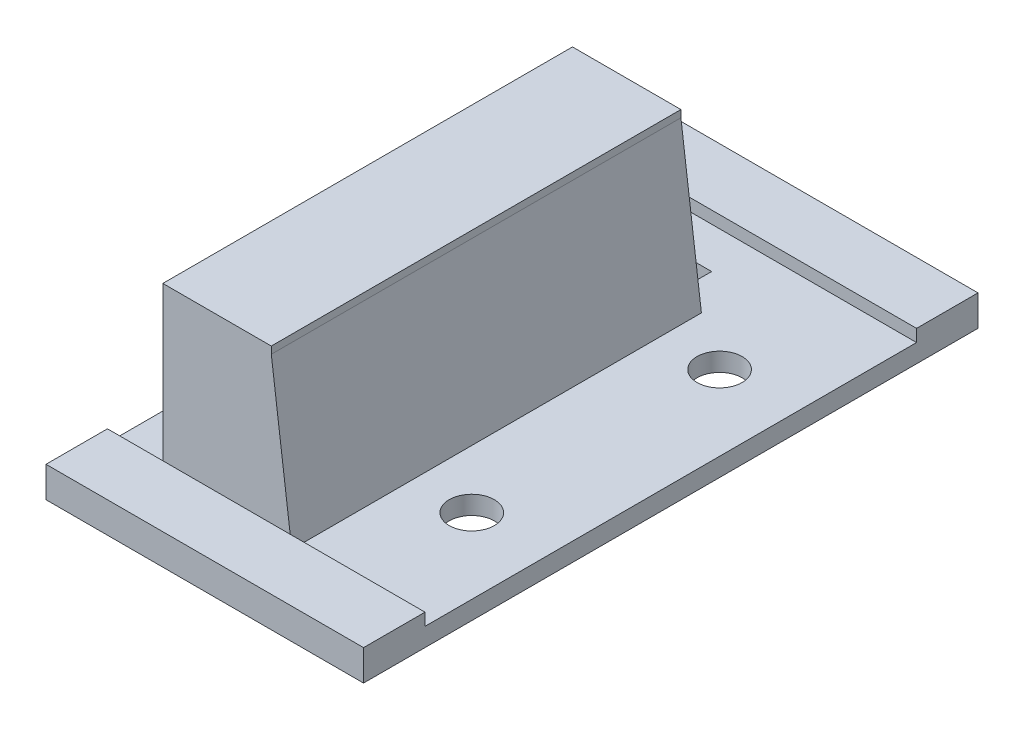
from build123d import *

# Parameters (mm, degrees)
BOSS_EXTRUDE2_DEPTH   = 3.81
BOSS_EXTRUDE2_2_DEPTH = 3.81
SKETCH2_3_W           = 39.3827
SKETCH2_3_H           = 60.96
SKETCH2_3_R           = 2.794
SKETCH2_3_W_2         = 7.874
SKETCH2_3_H_2         = 50.8
BOSS_EXTRUDE3_DEPTH   = 2.286
SKETCH2_4_W           = 0.75
SKETCH2_4_H           = 50.8
BOSS_EXTRUDE4_DEPTH   = 22.86
SKETCH7_W             = 50.8
SKETCH7_H             = 0.889
BOSS_EXTRUDE6_DEPTH   = 12.7
BOSS_EXTRUDE7_DEPTH   = 0.889
BOSS_EXTRUDE8_DEPTH   = 50.8
SKETCH10_W            = 11.873277716
SKETCH10_H            = 49.911
CUT_EXTRUDE5_DEPTH    = 89.208426668


with BuildPart() as part:
    # Sketch2 → Boss-Extrude2 (new body)
    with BuildSketch(Plane(origin=(0, 0, 0), x_dir=(1, 0, 0), z_dir=(0, 1, 0))):
        Polygon((0, 7.62), (0, 0), (39.3827, 0), (39.3827, 7.62), (7.62, 7.62), (6.87, 7.62), align=None)
    extrude(amount=BOSS_EXTRUDE2_DEPTH)



with BuildPart() as body_2:
    # Sketch2 → Boss-Extrude2 2 (new body)
    with BuildSketch(Plane(origin=(0, 0, 0), x_dir=(1, 0, 0), z_dir=(0, 1, 0))):
        Polygon((0, 76.2), (0, 68.58), (6.87, 68.58), (7.62, 68.58), (39.3827, 68.58), (39.3827, 76.2), align=None)
    extrude(amount=BOSS_EXTRUDE2_2_DEPTH)


with BuildPart() as part_1:
    add(part.part)

    add(body_2.part)  # Boss-Extrude3 merges body 2
    # Sketch2<3> → Boss-Extrude3 (add)
    with BuildSketch(Plane(origin=(0, 0, 0), x_dir=(1, 0, 0), z_dir=(0, 1, 0))):
        with Locations((19.69135, 38.1)):
            Rectangle(SKETCH2_3_W, SKETCH2_3_H)
        with Locations(Location((30.067932262, 53.467, 0), (0, 0, 270))):
            Circle(SKETCH2_3_R, mode=Mode.SUBTRACT)
        with Locations((15.113, 38.1)):
            Rectangle(SKETCH2_3_W_2, SKETCH2_3_H_2, mode=Mode.SUBTRACT)
        with Locations(Location((30.067932262, 22.733, 0), (0, 0, 270))):
            Circle(SKETCH2_3_R, mode=Mode.SUBTRACT)
    extrude(amount=BOSS_EXTRUDE3_DEPTH)

    # Sketch2<4> → Boss-Extrude4 (add)
    with BuildSketch(Plane(origin=(0, 0, 0), x_dir=(1, 0, 0), z_dir=(0, 1, 0))):
        with Locations((7.245, 33.02)):
            Rectangle(SKETCH2_4_W, SKETCH2_4_H)
    extrude(amount=BOSS_EXTRUDE4_DEPTH)

    # Sketch7 → Boss-Extrude6 (add)
    with BuildSketch(Plane(origin=(7.62, 0, 0), x_dir=(0, 0, -1), z_dir=(1, 0, 0))):
        with Locations((33.02, 22.4155)):
            Rectangle(SKETCH7_W, SKETCH7_H)
    extrude(amount=BOSS_EXTRUDE6_DEPTH)

    # Sketch8 → Boss-Extrude7 (add)
    with BuildSketch(Plane(origin=(0, 0, -7.62), x_dir=(-1, 0, 0), z_dir=(0, 0, -1))):
        Polygon((-21.895037632, 3.81), (-7.62, 3.81), (-7.62, 20.64426719), (-8.94673281, 21.971), (-17.961616695, 21.971), (-19.689000062, 20.906791166), align=None)
        Polygon((-21.017277716, 2.286), (-21.895037632, 3.81), (-22.091682793, 2.286), align=None)
        Polygon((-9.144, 2.286), (-7.62, 2.286), (-7.62, 3.81), align=None)
        Polygon((-8.94673281, 21.971), (-7.62, 20.64426719), (-7.62, 21.971), align=None)
        Polygon((-19.551682793, 21.971), (-19.689000062, 20.906791166), (-17.961616695, 21.971), align=None)
        Polygon((-9.144, 2.286), (-7.62, 3.81), (-21.895037632, 3.81), (-21.017277716, 2.286), align=None)
    extrude(amount=BOSS_EXTRUDE7_DEPTH)

    # Sketch8<4> → Boss-Extrude8 (add)
    with BuildSketch(Plane(origin=(0, 0, -7.62), x_dir=(-1, 0, 0), z_dir=(0, 0, -1))):
        Polygon((-22.663354839, 3.81), (-21.895037632, 3.81), (-19.689000062, 20.906791166), (-19.551682793, 21.971), (-20.32, 21.971), align=None)
        Polygon((-22.091682793, 2.286), (-21.895037632, 3.81), (-22.663354839, 3.81), (-22.86, 2.286), align=None)
        Polygon((-21.017277716, 2.286), (-21.895037632, 3.81), (-22.091682793, 2.286), align=None)
        Polygon((-9.144, 2.286), (-7.62, 2.286), (-7.62, 3.81), align=None)
        Polygon((-19.551682793, 21.971), (-19.689000062, 20.906791166), (-17.961616695, 21.971), align=None)
        Polygon((-8.94673281, 21.971), (-7.62, 20.64426719), (-7.62, 21.971), align=None)
    extrude(amount=BOSS_EXTRUDE8_DEPTH)

    # Sketch10 → Cut-Extrude5 (cut, through all)
    with BuildSketch(Plane(origin=(0, 2.286, 0), x_dir=(1, 0, 0), z_dir=(0, 1, 0))):
        with Locations((15.080638858, 33.4645)):
            Rectangle(SKETCH10_W, SKETCH10_H)
    extrude(amount=-CUT_EXTRUDE5_DEPTH, mode=Mode.SUBTRACT)


solid = part_1.part
